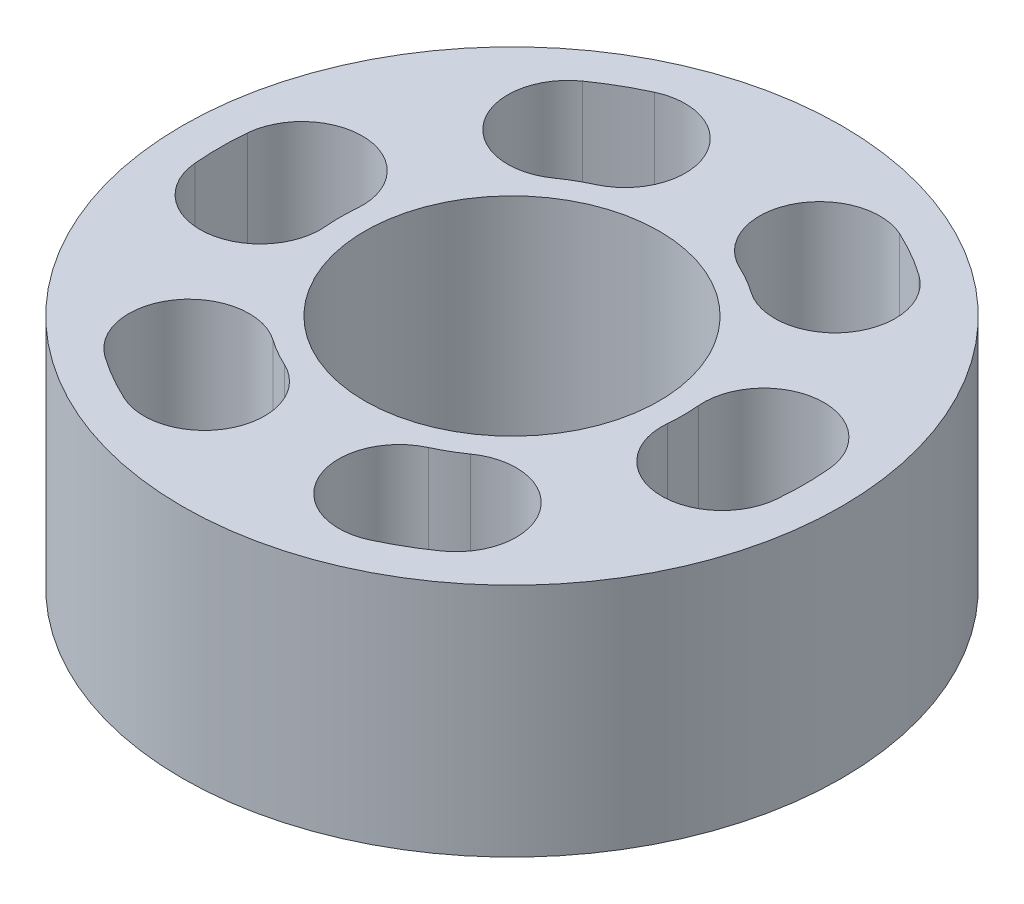
from build123d import *

# Parameters (mm, degrees)
SKETCH1_R           = 17.78
SKETCH1_R_2         = 7.9375
BOSS_EXTRUDE1_DEPTH = 12.7
CUT_EXTRUDE1_DEPTH  = 29.169962726
CIRPATTERN1_COUNT   = 6


with BuildPart() as part:
    # Sketch1 → Boss-Extrude1 (new body)
    with BuildSketch(Plane(origin=(0, 0, 0), x_dir=(1, 0, 0), z_dir=(0, 1, 0))):
        with Locations(Location((0, 0, 0), (0, 0, 270))):
            Circle(SKETCH1_R)
        with Locations(Location((0, 0, 0), (0, 0, 270))):
            Circle(SKETCH1_R_2, mode=Mode.SUBTRACT)
    extrude(amount=BOSS_EXTRUDE1_DEPTH)

    # Sketch2 → Cut-Extrude1 (cut, through all)
    with BuildSketch(Plane(origin=(0, 12.7, 0), x_dir=(1, 0, 0), z_dir=(0, 1, 0))):
        with BuildLine():
            ThreePointArc((6.615, 14.293504644), (7.875, 13.63990011), (9.071038131, 12.875510368))
            ThreePointArc((9.071038131, 12.875510368), (9.856087957, 8.346857503), (5.327435093, 7.561807676))
            ThreePointArc((5.327435093, 7.561807676), (4.625, 8.010734985), (3.885, 8.394597965))
            ThreePointArc((3.885, 8.394597965), (2.300546661, 12.709051305), (6.615, 14.293504644))
        make_face()
    cut_extrude1 = extrude(amount=-CUT_EXTRUDE1_DEPTH, mode=Mode.SUBTRACT)

    # CirPattern1: Cut-Extrude1 ×6 about axis
    cirpattern1_axis = Axis((0, 0, 0), (0, 1, 0))
    for i in range(1, CIRPATTERN1_COUNT):
        add(cut_extrude1.rotate(cirpattern1_axis, i * 360 / CIRPATTERN1_COUNT), mode=Mode.SUBTRACT)


solid = part.part
